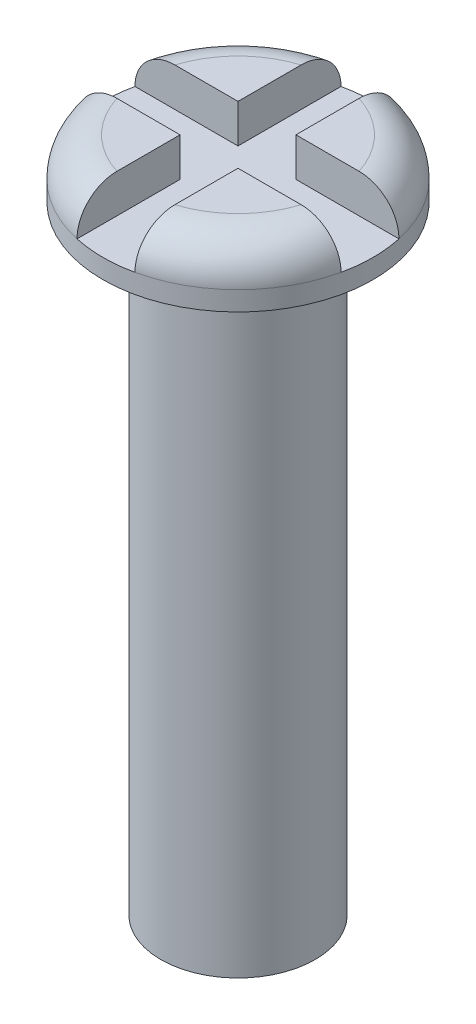
from build123d import *

# Parameters (mm, degrees)
SKETCH_1_R          = 1
EXTRUDE_1_DEPTH     = 8
SKETCH_2_R          = 1.75
EXTRUDE_2_DEPTH     = 0.75
FILLET_1_R          = 0.5
SKETCH_3_W          = 7.004697232
SKETCH_3_H          = 0.75
CUT_EXTRUDE_1_DEPTH = 0.5
SKETCH_4_W          = 0.75
SKETCH_4_H          = 3.75
CUT_EXTRUDE_2_DEPTH = 0.5


with BuildPart() as part:
    # 草图1 → 拉伸1 (new body)
    with BuildSketch(Plane(origin=(0, 0, 0), x_dir=(1, 0, 0), z_dir=(0, 1, 0))):
        with Locations(Location((0, 0, 0), (0, 0, 270))):
            Circle(SKETCH_1_R)
    extrude(amount=EXTRUDE_1_DEPTH)

    # 草图2 → 拉伸2 (add)
    with BuildSketch(Plane(origin=(0, 8, 0), x_dir=(-1, 0, 0), z_dir=(0, 1, 0))):
        with Locations(Location((0, 0, 0), (0, 0, 90))):
            Circle(SKETCH_2_R)
    extrude(amount=EXTRUDE_2_DEPTH)

    # 圆角1
    fillet_1_edges = [part.edges().sort_by_distance(p)[0] for p in [
        (0, 8.75, -1.75),
    ]]
    fillet(fillet_1_edges, radius=FILLET_1_R)

    # 草图3 → 切除-拉伸1 (cut)
    with BuildSketch(Plane(origin=(0, 8.75, 0), x_dir=(-1, 0, 0), z_dir=(0, 1, 0))):
        Rectangle(SKETCH_3_W, SKETCH_3_H)
    extrude(amount=-CUT_EXTRUDE_1_DEPTH, mode=Mode.SUBTRACT)

    # 草图4 → 切除-拉伸2 (cut)
    with BuildSketch(Plane(origin=(0, 8.75, 0), x_dir=(-1, 0, 0), z_dir=(0, 1, 0))):
        Rectangle(SKETCH_4_W, SKETCH_4_H)
    extrude(amount=-CUT_EXTRUDE_2_DEPTH, mode=Mode.SUBTRACT)


solid = part.part
